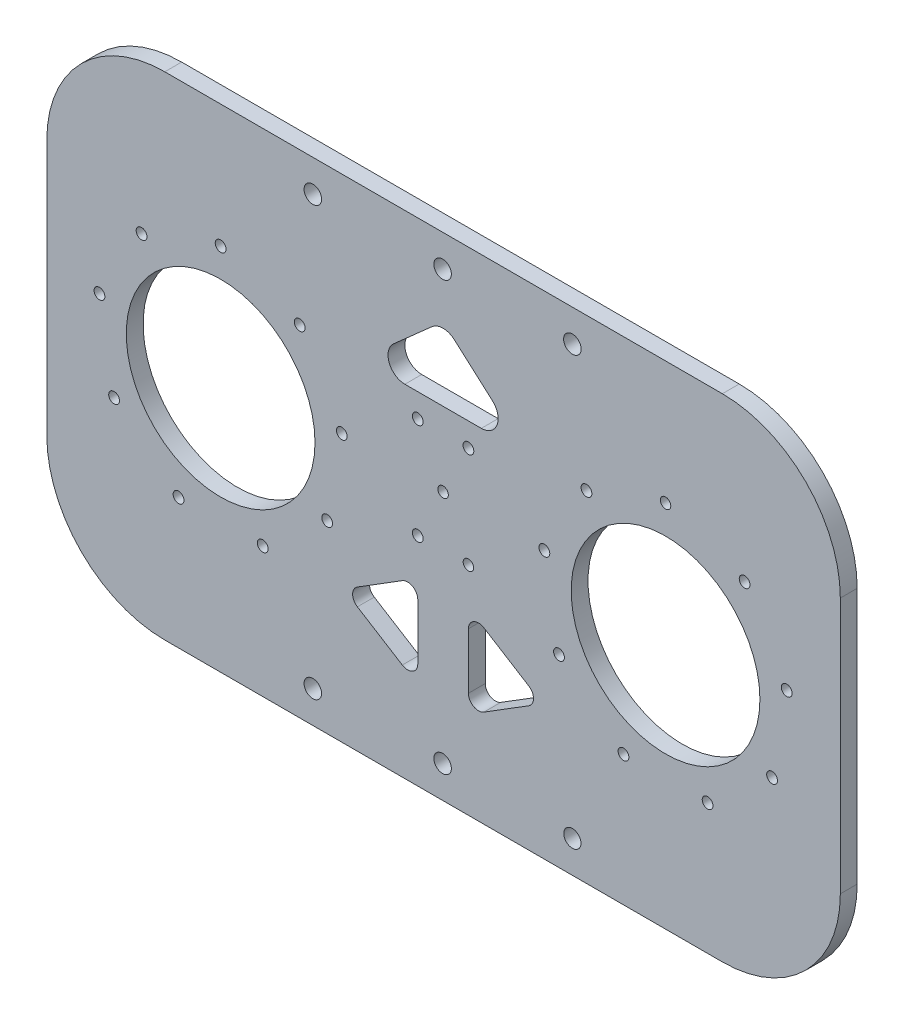
from build123d import *

# Parameters (mm, degrees)
SKETCH_1_R          = 2.6
SKETCH_1_R_2        = 2.55
SKETCH_1_R_3        = 1.6
SKETCH_1_R_4        = 1.55
SKETCH_1_R_5        = 28
EXTRUDE_2_DEPTH     = 5
CUT_EXTRUDE_1_DEPTH = 10
SKETCH_4_R          = 1.6
SKETCH_4_R_2        = 1.55
CUT_EXTRUDE_2_DEPTH = 10
SKETCH_6_R          = 1.55
CUT_EXTRUDE_3_DEPTH = 10
FILLET_4_R          = 3
FILLET_5_R          = 3
FILLET_6_R          = 3
FILLET_7_R          = 3
FILLET_8_R          = 3
FILLET_9_R          = 3
FILLET_10_R         = 5
FILLET_11_R         = 5
FILLET_12_R         = 5


with BuildPart() as part:
    # 草图1 → 凸台-拉伸2 (new body)
    with BuildSketch(Plane.XY):
        Polygon((-63, 73), (47, 73), (55, 73), (55, -73), (47, -73), (-173, -73), (-180.424412423, -73), (-180.424412423, 73), (-172.424412423, 73), align=None)
        with Locations((-101.5, 63.5)):
            Circle(SKETCH_1_R, mode=Mode.SUBTRACT)
        with Locations((-63, 63.5)):
            Circle(SKETCH_1_R, mode=Mode.SUBTRACT)
        with Locations((-24.5, 63.5)):
            Circle(SKETCH_1_R, mode=Mode.SUBTRACT)
        with Locations((-24.5, -63.5)):
            Circle(SKETCH_1_R_2, mode=Mode.SUBTRACT)
        with Locations((-63, -63.5)):
            Circle(SKETCH_1_R, mode=Mode.SUBTRACT)
        with Locations((-101.5, -63.5)):
            Circle(SKETCH_1_R, mode=Mode.SUBTRACT)
        with Locations((-128.856103106, 36.5)):
            Circle(SKETCH_1_R_3, mode=Mode.SUBTRACT)
        with Locations((-152.317850859, 27.960622174)):
            Circle(SKETCH_1_R_3, mode=Mode.SUBTRACT)
        with Locations((-164.801586091, 6.338158485)):
            Circle(SKETCH_1_R_3, mode=Mode.SUBTRACT)
        with Locations((-160.466030344, -18.25)):
            Circle(SKETCH_1_R_3, mode=Mode.SUBTRACT)
        with Locations((-141.339838337, -34.298780659)):
            Circle(SKETCH_1_R_3, mode=Mode.SUBTRACT)
        with Locations((-116.372367874, -34.298780659)):
            Circle(SKETCH_1_R_3, mode=Mode.SUBTRACT)
        with Locations((-105.394355352, 27.960622174)):
            Circle(SKETCH_1_R_3, mode=Mode.SUBTRACT)
        with Locations((-92.910620121, 6.338158485)):
            Circle(SKETCH_1_R_3, mode=Mode.SUBTRACT)
        with Locations((-97.246175868, -18.25)):
            Circle(SKETCH_1_R_3, mode=Mode.SUBTRACT)
        with Locations((3.143896894, 36.5)):
            Circle(SKETCH_1_R_4, mode=Mode.SUBTRACT)
        with Locations((-20.317850859, 27.960622174)):
            Circle(SKETCH_1_R_3, mode=Mode.SUBTRACT)
        with Locations((-32.801586091, 6.338158485)):
            Circle(SKETCH_1_R_3, mode=Mode.SUBTRACT)
        with Locations((-28.466030344, -18.25)):
            Circle(SKETCH_1_R_3, mode=Mode.SUBTRACT)
        with Locations((-9.339838337, -34.298780659)):
            Circle(SKETCH_1_R_3, mode=Mode.SUBTRACT)
        with Locations((15.627632126, -34.298780659)):
            Circle(SKETCH_1_R_3, mode=Mode.SUBTRACT)
        with Locations((34.753824132, -18.25)):
            Circle(SKETCH_1_R_3, mode=Mode.SUBTRACT)
        with Locations((39.089379879, 6.338158485)):
            Circle(SKETCH_1_R_3, mode=Mode.SUBTRACT)
        with Locations((26.605644648, 27.960622174)):
            Circle(SKETCH_1_R_3, mode=Mode.SUBTRACT)
        with Locations((-128.856103106, 0)):
            Circle(SKETCH_1_R_5, mode=Mode.SUBTRACT)
        with Locations((3.143896894, 0)):
            Circle(SKETCH_1_R_5, mode=Mode.SUBTRACT)
    extrude(amount=EXTRUDE_2_DEPTH)

    # 草图3 → 切除-拉伸1 (cut)
    with BuildSketch(Plane.XY.offset(5)):
        with BuildLine():
            Line((-180.424412423, 73), (-180.424412423, 38))
            ThreePointArc((-180.424412423, 38), (-170.173149765, 62.748737342), (-145.424412423, 73))
            Line((-145.424412423, 73), (-180.424412423, 73))
        make_face()
        with BuildLine():
            Line((-180.424412423, -73), (-180.424412423, -38))
            ThreePointArc((-180.424412423, -38), (-170.173149765, -62.748737342), (-145.424412423, -73))
            Line((-145.424412423, -73), (-180.424412423, -73))
        make_face()
        with BuildLine():
            Line((55, 73), (20, 73))
            ThreePointArc((20, 73), (44.748737342, 62.748737342), (55, 38))
            Line((55, 38), (55, 73))
        make_face()
        with BuildLine():
            Line((55, -38), (55, -73))
            Line((55, -73), (20, -73))
            ThreePointArc((20, -73), (44.748737342, -62.748737342), (55, -38))
        make_face()
    extrude(amount=-CUT_EXTRUDE_1_DEPTH, mode=Mode.SUBTRACT)

    # 草图4 → 切除-拉伸2 (cut)
    with BuildSketch(Plane.XY.offset(5)):
        with Locations((-70.36973236, 21.338158485)):
            Circle(SKETCH_4_R)
        with Locations((-55.342473852, 21.338158485)):
            Circle(SKETCH_4_R)
        with Locations((-70.36973236, -8.661841515)):
            Circle(SKETCH_4_R)
        with Locations((-55.342473852, -8.661841515)):
            Circle(SKETCH_4_R_2)
    extrude(amount=-CUT_EXTRUDE_2_DEPTH, mode=Mode.SUBTRACT)

    # 草图6 → 切除-拉伸3 (cut)
    with BuildSketch(Plane.XY.offset(5)):
        with Locations((-62.856103106, 6.338158485)):
            Circle(SKETCH_6_R)
        Polygon((-82.36973236, 28.338158485), (-87.36973236, 28.338158485), (-62.856103106, 50.070242379), (-38.342473852, 28.338158485), (-43.342473852, 28.338158485), align=None)
        Polygon((-70.36973236, -19.661841515), (-70.36973236, -47.040526198), (-92.36973236, -33.351183857), align=None)
        Polygon((-55.342473852, -19.661841515), (-55.342473852, -47.040526198), (-33.342473852, -33.351183857), align=None)
    extrude(amount=-CUT_EXTRUDE_3_DEPTH, mode=Mode.SUBTRACT)

    # 圆角4
    fillet_4_edges = [part.edges().sort_by_distance(p)[0] for p in [
        (-70.36973236, -19.661841515, 2.5),
    ]]
    fillet(fillet_4_edges, radius=FILLET_4_R)

    # 圆角5
    fillet_5_edges = [part.edges().sort_by_distance(p)[0] for p in [
        (-92.36973236, -33.351183857, 2.5),
    ]]
    fillet(fillet_5_edges, radius=FILLET_5_R)

    # 圆角6
    fillet_6_edges = [part.edges().sort_by_distance(p)[0] for p in [
        (-70.36973236, -47.040526198, 2.5),
    ]]
    fillet(fillet_6_edges, radius=FILLET_6_R)

    # 圆角7
    fillet_7_edges = [part.edges().sort_by_distance(p)[0] for p in [
        (-55.342473852, -47.040526198, 2.5),
    ]]
    fillet(fillet_7_edges, radius=FILLET_7_R)

    # 圆角8
    fillet_8_edges = [part.edges().sort_by_distance(p)[0] for p in [
        (-55.342473852, -19.661841515, 2.5),
    ]]
    fillet(fillet_8_edges, radius=FILLET_8_R)

    # 圆角9
    fillet_9_edges = [part.edges().sort_by_distance(p)[0] for p in [
        (-33.342473852, -33.351183857, 2.5),
    ]]
    fillet(fillet_9_edges, radius=FILLET_9_R)

    # 圆角10
    fillet_10_edges = [part.edges().sort_by_distance(p)[0] for p in [
        (-62.856103106, 50.070242379, 2.5),
    ]]
    fillet(fillet_10_edges, radius=FILLET_10_R)

    # 圆角11
    fillet_11_edges = [part.edges().sort_by_distance(p)[0] for p in [
        (-87.36973236, 28.338158485, 2.5),
    ]]
    fillet(fillet_11_edges, radius=FILLET_11_R)

    # 圆角12
    fillet_12_edges = [part.edges().sort_by_distance(p)[0] for p in [
        (-38.342473852, 28.338158485, 2.5),
    ]]
    fillet(fillet_12_edges, radius=FILLET_12_R)


solid = part.part
